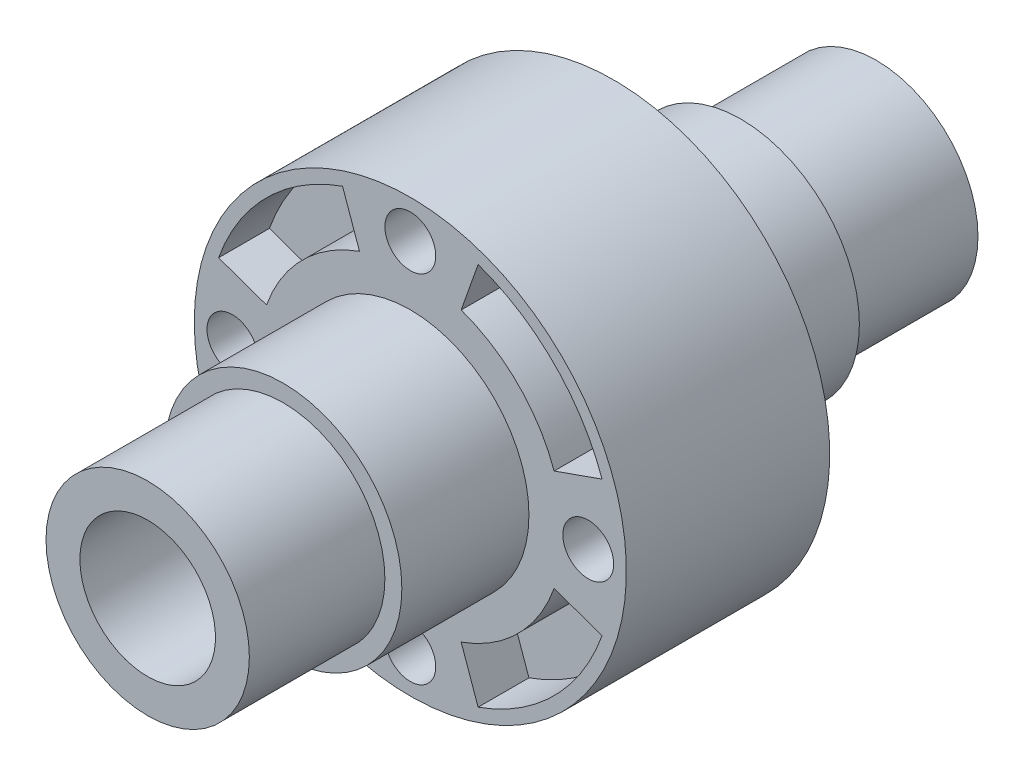
from build123d import *

# Parameters (mm, degrees)
SKETCH_2_R          = 1.5
CUT_EXTRUDE_1_DEPTH = 34.88583775
SKETCH_4_R          = 14
SKETCH_4_R_2        = 12.75
CUT_EXTRUDE_4_DEPTH = 34.88583775
CUT_EXTRUDE_5_DEPTH = 3
SKETCH_6_R          = 4
CUT_EXTRUDE_6_DEPTH = 47.627513337


with BuildPart() as part:
    # 草图1 → 旋转1 (revolve)
    with BuildSketch(Plane(origin=(0, 0, 0), x_dir=(0, 0, -1), z_dir=(1, 0, 0)), mode=Mode.PRIVATE) as revolve_1_sk:
        Polygon((-21.5, 0), (-21.5, 6), (-13.5, 6), (-13.5, 7), (-6, 7), (-6, 14), (6, 14), (6, 7), (13.5, 7), (13.5, 6), (21.5, 6), (21.5, 0), align=None)
    revolve(revolve_1_sk.sketch.rotate(Axis((0, 0, 21.5), (0, 0, -1)), 90), axis=Axis((0, 0, 21.5), (0, 0, -1)))

    # 草图2 → 切除-拉伸1 (cut, through all)
    with BuildSketch(Plane.XY.offset(6)):
        with Locations((0, 10.5)):
            Circle(SKETCH_2_R)
        with Locations((10.5, 0)):
            Circle(SKETCH_2_R)
        with Locations((0, -10.5)):
            Circle(SKETCH_2_R)
        with Locations((-10.5, 0)):
            Circle(SKETCH_2_R)
    extrude(amount=-CUT_EXTRUDE_1_DEPTH, mode=Mode.SUBTRACT)

    # 草图4 → 切除-拉伸4 (cut, through all)
    with BuildSketch(Plane(origin=(0, 0, -6), x_dir=(-1, 0, 0), z_dir=(0, 0, -1))):
        Circle(SKETCH_4_R)
        Circle(SKETCH_4_R_2, mode=Mode.SUBTRACT)
    extrude(amount=-CUT_EXTRUDE_4_DEPTH, mode=Mode.SUBTRACT)

    # 草图5 → 切除-拉伸5 (cut)
    with BuildSketch(Plane(origin=(0, 0, -6), x_dir=(-1, 0, 0), z_dir=(0, 0, -1))):
        with BuildLine():
            Line((-11.313708499, 4), (-8.485281374, 3))
            ThreePointArc((-8.485281374, 3), (-6.363961031, 6.363961031), (-3, 8.485281374))
            Line((-3, 8.485281374), (-4, 11.313708499))
            ThreePointArc((-4, 11.313708499), (-8.485281374, 8.485281374), (-11.313708499, 4))
        make_face()
        with BuildLine():
            Line((4, 11.313708499), (3, 8.485281374))
            ThreePointArc((3, 8.485281374), (6.363961031, 6.363961031), (8.485281374, 3))
            Line((8.485281374, 3), (11.313708499, 4))
            ThreePointArc((11.313708499, 4), (8.485281374, 8.485281374), (4, 11.313708499))
        make_face()
        with BuildLine():
            Line((11.313708499, -4), (8.485281374, -3))
            ThreePointArc((8.485281374, -3), (6.363961031, -6.363961031), (3, -8.485281374))
            Line((3, -8.485281374), (4, -11.313708499))
            ThreePointArc((4, -11.313708499), (8.485281374, -8.485281374), (11.313708499, -4))
        make_face()
        with BuildLine():
            Line((-4, -11.313708499), (-3, -8.485281374))
            ThreePointArc((-3, -8.485281374), (-6.363961031, -6.363961031), (-8.485281374, -3))
            Line((-8.485281374, -3), (-11.313708499, -4))
            ThreePointArc((-11.313708499, -4), (-8.485281374, -8.485281374), (-4, -11.313708499))
        make_face()
    cut_extrude_5 = extrude(amount=-CUT_EXTRUDE_5_DEPTH, mode=Mode.SUBTRACT)

    # 镜向2: 切除-拉伸5 across plane
    add(cut_extrude_5.mirror(Plane.XY), mode=Mode.SUBTRACT)

    # 草图6 → 切除-拉伸6 (cut, through all)
    with BuildSketch(Plane(origin=(0, 0, -21.5), x_dir=(-1, 0, 0), z_dir=(0, 0, -1))):
        Circle(SKETCH_6_R)
    extrude(amount=-CUT_EXTRUDE_6_DEPTH, mode=Mode.SUBTRACT)


solid = part.part
